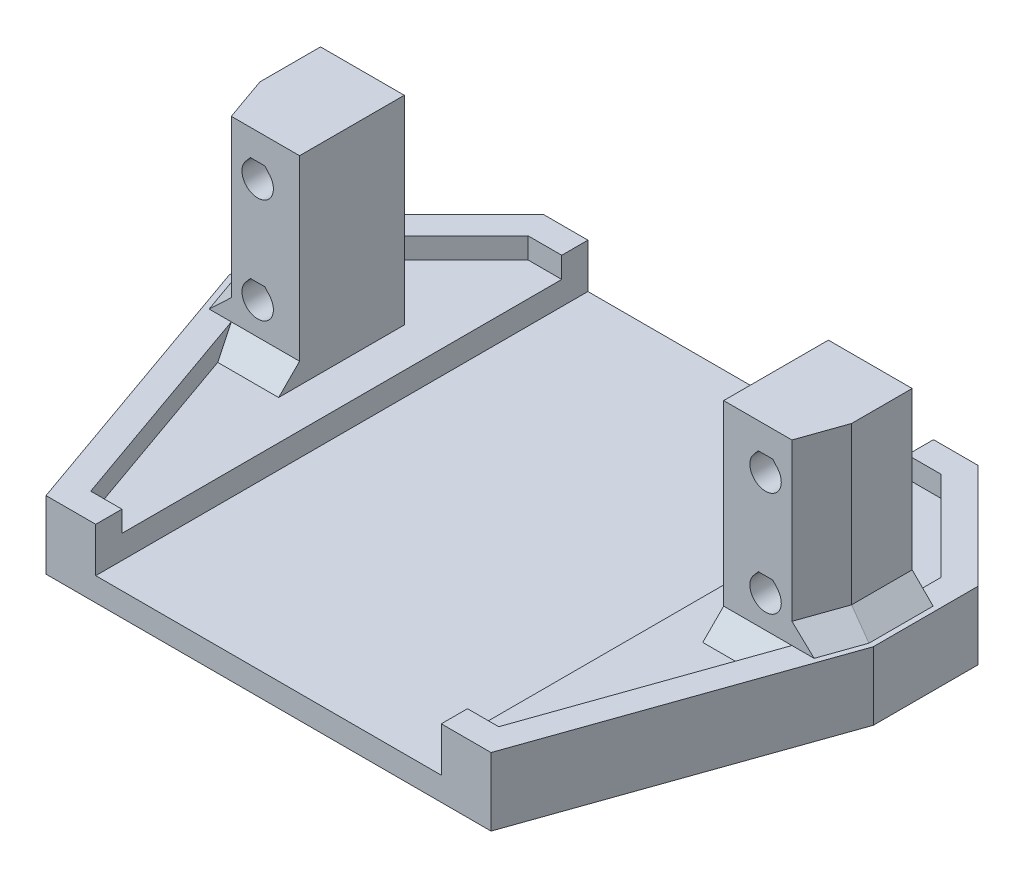
from build123d import *

# Parameters (mm, degrees)
BOSS_EXTRUDE1_DEPTH = 4.5
SKETCH2_W           = 33
SKETCH2_H           = 47
CUT_EXTRUDE1_DEPTH  = 2.25
BOSS_EXTRUDE2_DEPTH = 2
BOSS_EXTRUDE3_DEPTH = 19
CHAMFER1_SIZE       = 2
CHAMFER2_SIZE       = 2
CUT_EXTRUDE2_REACH  = 45.27


with BuildPart() as part:
    # Sketch1 → Boss-Extrude1 (new body)
    with BuildSketch(Plane(origin=(0, 0, 0), x_dir=(1, 0, 0), z_dir=(0, 1, 0))):
        Polygon((21.25, 0), (-21.25, 0), (-30.75, 27), (-30.75, 37), (-20.75, 47), (20.75, 47), (30.75, 37), (30.75, 27), align=None)
    extrude(amount=-BOSS_EXTRUDE1_DEPTH)

    # Sketch2 → Cut-Extrude1 (cut)
    with BuildSketch(Plane(origin=(0, 0, 0), x_dir=(1, 0, 0), z_dir=(0, 1, 0))):
        with Locations((0, 23.5)):
            Rectangle(SKETCH2_W, SKETCH2_H)
    extrude(amount=-CUT_EXTRUDE1_DEPTH, mode=Mode.SUBTRACT)

    # Sketch3 → Boss-Extrude2 (add)
    with BuildSketch(Plane(origin=(0, 0, 0), x_dir=(1, 0, 0), z_dir=(0, 1, 0))):
        Polygon((-21.25, 0), (-16.5, 0), (-16.5, 2.5), (-19.479394115, 2.5), (-28.25, 27.426985148), (-28.25, 35.964466094), (-19.714466094, 44.5), (-16.5, 44.5), (-16.5, 47), (-20.75, 47), (-30.75, 37), (-30.75, 27), align=None)
        Polygon((16.5, 0), (21.25, 0), (30.75, 27), (30.75, 37), (20.75, 47), (16.5, 47), (16.5, 44.5), (19.714466094, 44.5), (28.25, 35.964466094), (28.25, 27.426985148), (19.479394115, 2.5), (16.5, 2.5), align=None)
    extrude(amount=BOSS_EXTRUDE2_DEPTH)

    # Sketch4 → Boss-Extrude3 (add)
    with BuildSketch(Plane(origin=(0, 0, 0), x_dir=(1, 0, 0), z_dir=(0, 1, 0))):
        Polygon((-20.25, 33.214466094), (-20.25, 23.214466094), (-26.76781737, 23.214466094), (-28.25, 27.426985148), (-28.25, 33.214466094), align=None)
        Polygon((20.25, 23.214466094), (20.25, 33.214466094), (28.25, 33.214466094), (28.25, 27.426985148), (26.76781737, 23.214466094), align=None)
    extrude(amount=BOSS_EXTRUDE3_DEPTH)

    # Chamfer1
    chamfer1_edges = [part.edges().sort_by_distance(p)[0] for p in [
        (-27.508908685, 2, -25.320725621),
        (28.25, 2, -30.320725621),
        (-28.25, 2, -30.320725621),
        (27.508908685, 2, -25.320725621),
    ]]
    chamfer(chamfer1_edges, length=CHAMFER1_SIZE)

    # Chamfer2
    chamfer2_edges = [part.edges().sort_by_distance(p)[0] for p in [
        (23.508908685, 0, -23.214466094),
        (-23.508908685, 0, -23.214466094),
    ]]
    chamfer(chamfer2_edges, length=CHAMFER2_SIZE)

    # Sketch5 → Cut-Extrude2 (cut, up to next)
    with BuildSketch(Plane.XY.offset(-23.214466094), mode=Mode.PRIVATE) as cut_extrude2_sk1:
        with BuildLine():
            Line((-24.949461487, 16.5), (-25.399066665, 15.964181415))
            ThreePointArc((-25.399066665, 15.964181415), (-24.25, 13.5), (-23.100933335, 15.964181415))
            Line((-23.100933335, 15.964181415), (-23.550538513, 16.5))
            Line((-23.550538513, 16.5), (-24.949461487, 16.5))
        make_face()
    cut_extrude2_tool1 = extrude(cut_extrude2_sk1.sketch, amount=-CUT_EXTRUDE2_REACH, mode=Mode.PRIVATE) & part.part
    # Sketch5 → Cut-Extrude2 (cut, up to next)
    with BuildSketch(Plane.XY.offset(-23.214466094), mode=Mode.PRIVATE) as cut_extrude2_sk2:
        with BuildLine():
            Line((-23.100933335, 5.964181415), (-23.550538513, 6.5))
            Line((-23.550538513, 6.5), (-24.949461487, 6.5))
            Line((-24.949461487, 6.5), (-25.399066665, 5.964181415))
            ThreePointArc((-25.399066665, 5.964181415), (-24.25, 3.5), (-23.100933335, 5.964181415))
        make_face()
    cut_extrude2_tool2 = extrude(cut_extrude2_sk2.sketch, amount=-CUT_EXTRUDE2_REACH, mode=Mode.PRIVATE) & part.part
    # Sketch5 → Cut-Extrude2 (cut, up to next)
    with BuildSketch(Plane.XY.offset(-23.214466094), mode=Mode.PRIVATE) as cut_extrude2_sk3:
        with BuildLine():
            Line((23.100933335, 5.964181415), (23.550538513, 6.5))
            Line((23.550538513, 6.5), (24.949461487, 6.5))
            Line((24.949461487, 6.5), (25.399066665, 5.964181415))
            ThreePointArc((25.399066665, 5.964181415), (24.25, 3.5), (23.100933335, 5.964181415))
        make_face()
    cut_extrude2_tool3 = extrude(cut_extrude2_sk3.sketch, amount=-CUT_EXTRUDE2_REACH, mode=Mode.PRIVATE) & part.part
    # Sketch5 → Cut-Extrude2 (cut, up to next)
    with BuildSketch(Plane.XY.offset(-23.214466094), mode=Mode.PRIVATE) as cut_extrude2_sk4:
        with BuildLine():
            Line((24.949461487, 16.5), (25.399066665, 15.964181415))
            ThreePointArc((25.399066665, 15.964181415), (24.25, 13.5), (23.100933335, 15.964181415))
            Line((23.100933335, 15.964181415), (23.550538513, 16.5))
            Line((23.550538513, 16.5), (24.949461487, 16.5))
        make_face()
    cut_extrude2_tool4 = extrude(cut_extrude2_sk4.sketch, amount=-CUT_EXTRUDE2_REACH, mode=Mode.PRIVATE) & part.part
    add(cut_extrude2_tool1.solids().sort_by_distance((-24.25, 15.026014, -23.214466))[0], mode=Mode.SUBTRACT)
    add(cut_extrude2_tool2.solids().sort_by_distance((-24.25, 5.026014, -23.214466))[0], mode=Mode.SUBTRACT)
    add(cut_extrude2_tool3.solids().sort_by_distance((24.25, 5.026014, -23.214466))[0], mode=Mode.SUBTRACT)
    add(cut_extrude2_tool4.solids().sort_by_distance((24.25, 15.026014, -23.214466))[0], mode=Mode.SUBTRACT)


solid = part.part
